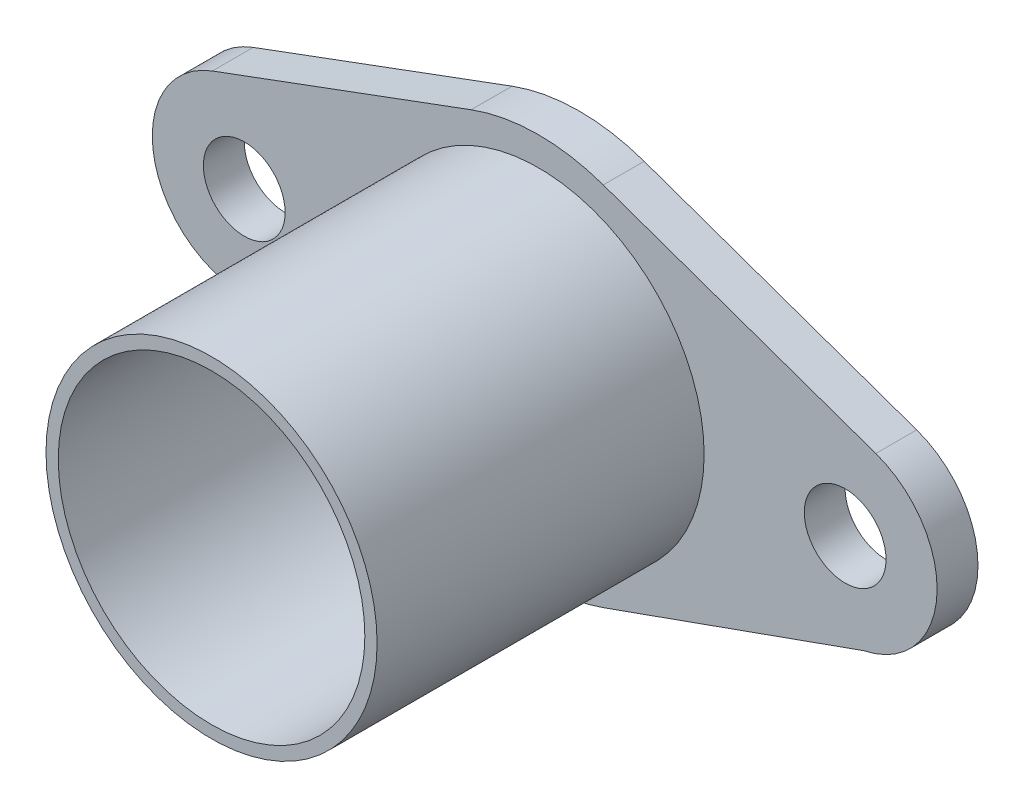
from build123d import *

# Parameters (mm, degrees)
SKETCH1_R           = 37.5
SKETCH1_R_2         = 10
BOSS_EXTRUDE1_DEPTH = 10
SKETCH2_R           = 40.5
SKETCH2_R_2         = 37.5
BOSS_EXTRUDE2_DEPTH = 80


with BuildPart() as part:
    # Sketch1 → Boss-Extrude1 (new body)
    with BuildSketch(Plane.XY):
        with BuildLine():
            Line((-79.8125, 21.10011478), (-16.493055556, 44.544686759))
            ThreePointArc((-16.493055556, 44.544686759), (-0.350796057, 47.498704636), (15.833333333, 44.783429475))
            Line((15.833333333, 44.783429475), (82.5, 21.213203436))
            ThreePointArc((82.5, 21.213203436), (97.448185953, -1.526088923), (79.56, -22.033075137))
            Line((79.56, -22.033075137), (15.970417375, -44.734726655))
            ThreePointArc((15.970417375, -44.734726655), (-0.27805837, -47.499186136), (-16.493055556, -44.544686759))
            Line((-16.493055556, -44.544686759), (-79.8125, -21.10011478))
            ThreePointArc((-79.8125, -21.10011478), (-94.5, 0), (-79.8125, 21.10011478))
        make_face()
        Circle(SKETCH1_R, mode=Mode.SUBTRACT)
        with Locations((-72, 0)):
            Circle(SKETCH1_R_2, mode=Mode.SUBTRACT)
        with Locations((75, 0)):
            Circle(SKETCH1_R_2, mode=Mode.SUBTRACT)
    extrude(amount=BOSS_EXTRUDE1_DEPTH)

    # Sketch2 → Boss-Extrude2 (add)
    with BuildSketch(Plane.XY.offset(10)):
        Circle(SKETCH2_R)
        Circle(SKETCH2_R_2, mode=Mode.SUBTRACT)
    extrude(amount=BOSS_EXTRUDE2_DEPTH)


solid = part.part
